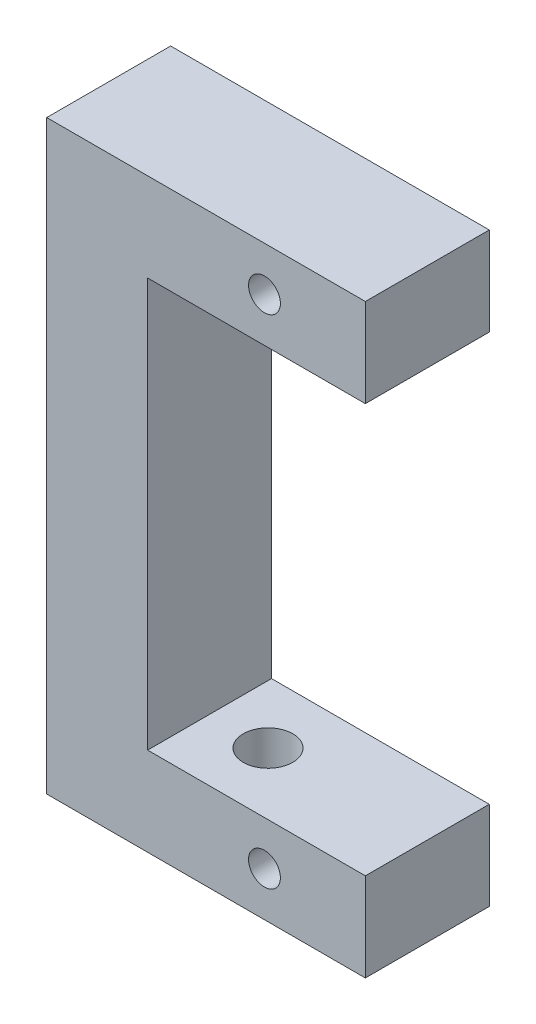
from build123d import *

# Parameters (mm, degrees)
ESTRUSIONE_ESTRUSIONE1_DEPTH = 7
SCHIZZO2_R                   = 0.9
TAGLIO_ESTRUSIONE1_DEPTH     = 21.420394218
TAGLIO_ESTRUSIONE2_REACH     = 37.195
SCHIZZO3_R                   = 1.4


with BuildPart() as part:
    # Schizzo1 → Estrusione-Estrusione1 (new body)
    with BuildSketch(Plane.XY):
        Polygon((8.3, 11.55), (-4, 11.55), (-4, -11.55), (8.3, -11.55), (8.3, -16.55), (-9.7, -16.55), (-9.7, 16.55), (8.3, 16.55), align=None)
    extrude(amount=ESTRUSIONE_ESTRUSIONE1_DEPTH)

    # Schizzo2 → Taglio-Estrusione1 (cut, through all)
    with BuildSketch(Plane.XY.offset(7)):
        with Locations((2.6, 14.05)):
            Circle(SCHIZZO2_R)
        with Locations(Location((2.6, -14.05, 0), (0, 0, 180))):
            Circle(SCHIZZO2_R)
    extrude(amount=-TAGLIO_ESTRUSIONE1_DEPTH, mode=Mode.SUBTRACT)

    # Schizzo3 → Taglio-Estrusione2 (cut, up to next)
    with BuildSketch(Plane.XZ.offset(16.55), mode=Mode.PRIVATE) as taglio_estrusione2_sk1:
        with Locations(Location((-0.7, 3.5, 0), (0, 0, 270))):
            Circle(SCHIZZO3_R)
    taglio_estrusione2_tool1 = extrude(taglio_estrusione2_sk1.sketch, amount=-TAGLIO_ESTRUSIONE2_REACH, mode=Mode.PRIVATE) & part.part
    add(taglio_estrusione2_tool1.solids().sort_by_distance((-0.7, -16.55, 3.5))[0], mode=Mode.SUBTRACT)


solid = part.part
